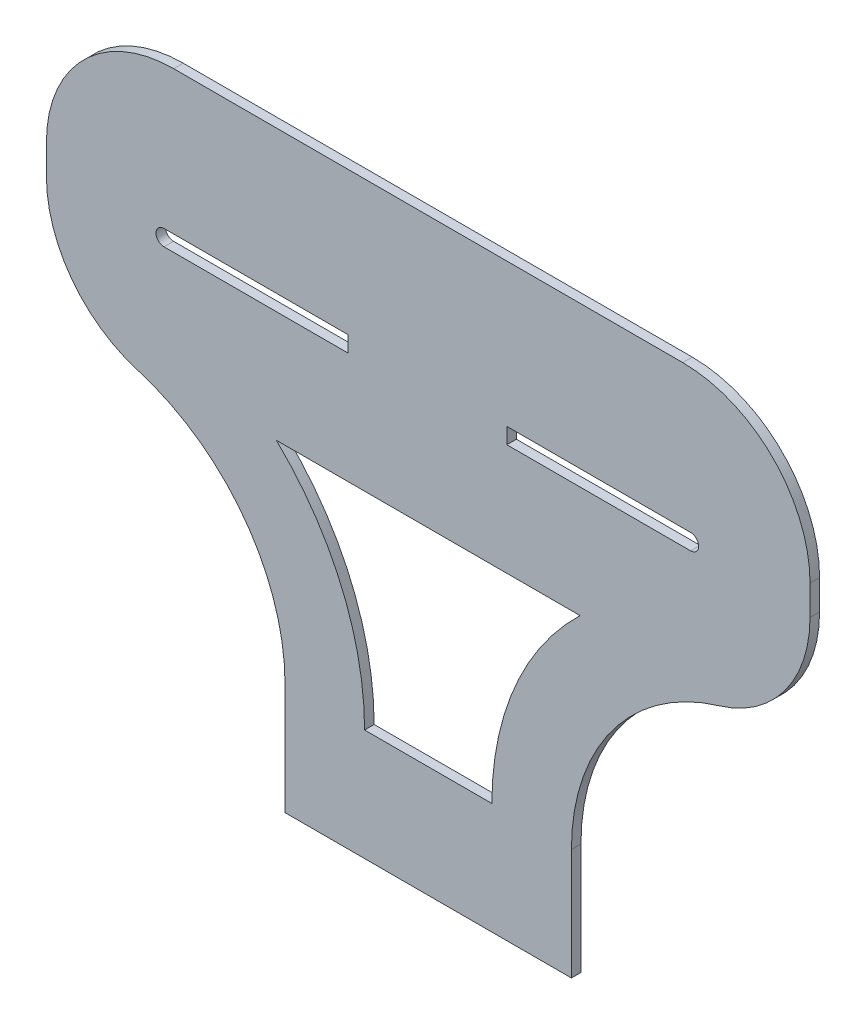
from build123d import *

# Parameters (mm, degrees)
RESSALTO_EXTRUS_O1_DEPTH = 6
FILETE1_R                = 80
CORTE_EXTRUS_O1_DEPTH    = 496.818515185
FILETE2_R                = 80
CORTE_EXTRUS_O2_DEPTH    = 496.818515327
CORTE_EXTRUS_O3_DEPTH    = 6
ESBO_O7_W                = 100
ESBO_O7_H                = 10
RESSALTO_EXTRUS_O4_DEPTH = 6


with BuildPart() as part:
    # Esboço1 → Ressalto-extrusão1 (new body)
    with BuildSketch(Plane.XY):
        Polygon((-150, 70), (0, 70), (0, 0), (180, 0), (180, 70), (330, 70), (330, 370), (-150, 370), align=None)
    extrude(amount=RESSALTO_EXTRUS_O1_DEPTH)

    # Filete1
    filete1_edges = [part.edges().sort_by_distance(p)[0] for p in [
        (-150, 370, 3),
        (330, 370, 3),
    ]]
    fillet(filete1_edges, radius=FILETE1_R)

    # Esboço4 → Corte-extrusão1 (cut, through all)
    with BuildSketch(Plane.XY.offset(6)):
        with BuildLine():
            Line((-150, 70), (0, 70))
            ThreePointArc((0, 70), (-36.716416622, 160.567770202), (-126.135181443, 200))
            Line((-126.135181443, 200), (-150, 200))
            Line((-150, 200), (-150, 70))
        make_face()
        with BuildLine():
            Line((330, 200), (306.135181443, 200))
            ThreePointArc((306.135181443, 200), (216.716416622, 160.567770202), (180, 70))
            Line((180, 70), (330, 70))
            Line((330, 70), (330, 200))
        make_face()
    extrude(amount=-CORTE_EXTRUS_O1_DEPTH, mode=Mode.SUBTRACT)

    # Filete2
    filete2_edges = [part.edges().sort_by_distance(p)[0] for p in [
        (330, 200, 3),
        (-150, 200, 3),
    ]]
    fillet(filete2_edges, radius=FILETE2_R)

    # Esboço5 → Corte-extrusão2 (cut, through all)
    with BuildSketch(Plane.XY.offset(6)):
        with BuildLine():
            Line((254.973969337, 280), (-76.120192614, 280))
            ThreePointArc((-76.120192614, 280), (-81.120192614, 275), (-76.120192614, 270))
            Line((-76.120192614, 270), (254.973969337, 270))
            ThreePointArc((254.973969337, 270), (259.973969337, 275), (254.973969337, 280))
        make_face()
    extrude(amount=-CORTE_EXTRUS_O2_DEPTH, mode=Mode.SUBTRACT)

    # Esboço6 → Corte-extrusão3 (cut)
    with BuildSketch(Plane.XY.offset(6)):
        with BuildLine():
            Line((50, 70), (130, 70.020316047))
            ThreePointArc((130, 70.020316047), (144.44257782, 140.677589128), (185.453428357, 200))
            Line((185.453428357, 200), (-5.474624038, 200))
            ThreePointArc((-5.474624038, 200), (35.551661067, 140.670775275), (50, 70))
        make_face()
    extrude(amount=-CORTE_EXTRUS_O3_DEPTH, mode=Mode.SUBTRACT)

    # Esboço7 → Ressalto-extrusão4 (add)
    with BuildSketch(Plane.XY.offset(6)):
        with Locations((89.426888362, 275)):
            Rectangle(ESBO_O7_W, ESBO_O7_H)
    extrude(amount=-RESSALTO_EXTRUS_O4_DEPTH)


solid = part.part
